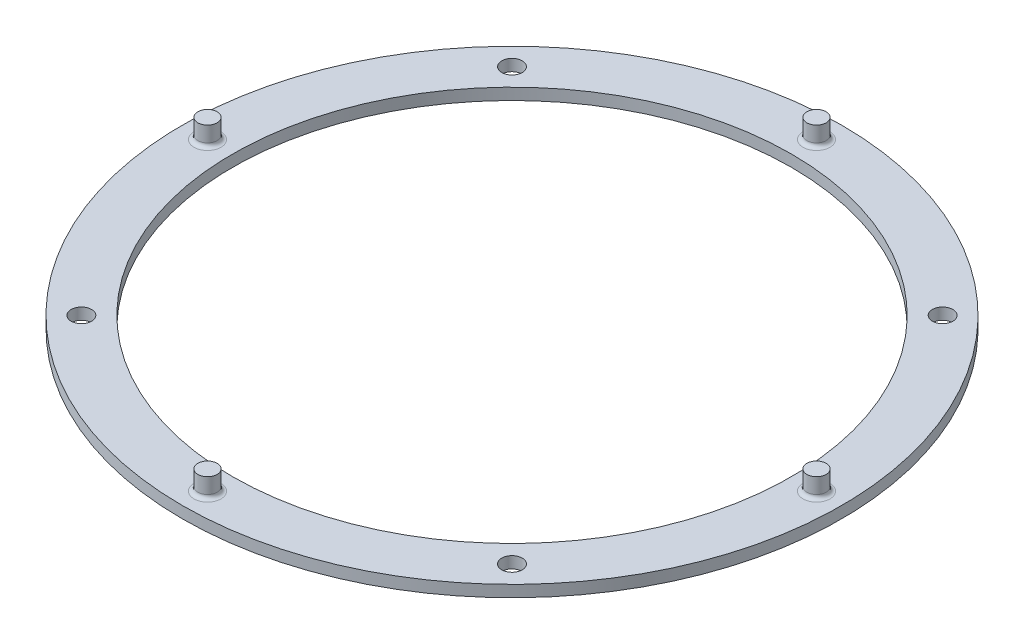
from build123d import *

# Parameters (mm, degrees)
SKETCH_1_R          = 85.5
SKETCH_1_R_2        = 72.5
EXTRUDE_1_DEPTH     = 3
SKETCH_2_R          = 2.5
EXTRUDE_4_DEPTH     = 5
FILLET_1_R          = 1
SKETCH_3_R          = 2.65
CUT_EXTRUDE_1_DEPTH = 5


with BuildPart() as part:
    # 草图1 → 凸台-拉伸1 (new body)
    with BuildSketch(Plane(origin=(0, 0, 0), x_dir=(1, 0, 0), z_dir=(0, 1, 0))):
        with Locations(Location((0, 0, 0), (0, 0, 270))):
            Circle(SKETCH_1_R)
        with Locations(Location((0, 0, 0), (0, 0, 270))):
            Circle(SKETCH_1_R_2, mode=Mode.SUBTRACT)
    extrude(amount=EXTRUDE_1_DEPTH)

    # 草图2 → 凸台-拉伸4 (add)
    with BuildSketch(Plane(origin=(0, 3, 0), x_dir=(1, 0, 0), z_dir=(0, 1, 0))):
        with Locations(Location((0, 79, 0), (0, 0, 270))):
            Circle(SKETCH_2_R)
        with Locations(Location((79, 0, 0), (0, 0, 270))):
            Circle(SKETCH_2_R)
        with Locations(Location((0, -79, 0), (0, 0, 270))):
            Circle(SKETCH_2_R)
        with Locations(Location((-79, 0, 0), (0, 0, 270))):
            Circle(SKETCH_2_R)
    extrude(amount=EXTRUDE_4_DEPTH)

    # 圆角1
    fillet_1_edges = [part.edges().sort_by_distance(p)[0] for p in [
        (0, 3, -81.5),
        (-79, 3, -2.5),
        (79, 3, -2.5),
        (0, 3, 76.5),
    ]]
    fillet(fillet_1_edges, radius=FILLET_1_R)

    # 草图3 → 切除-拉伸1 (cut)
    with BuildSketch(Plane(origin=(0, 3, 0), x_dir=(1, 0, 0), z_dir=(0, 1, 0))):
        with Locations(Location((55.861435714, 55.861435714, 0), (0, 0, 270))):
            Circle(SKETCH_3_R)
        with Locations(Location((55.861435714, -55.861435714, 0), (0, 0, 270))):
            Circle(SKETCH_3_R)
        with Locations(Location((-55.861435714, -55.861435714, 0), (0, 0, 270))):
            Circle(SKETCH_3_R)
        with Locations(Location((-55.861435714, 55.861435714, 0), (0, 0, 270))):
            Circle(SKETCH_3_R)
    extrude(amount=-CUT_EXTRUDE_1_DEPTH, mode=Mode.SUBTRACT)


solid = part.part
